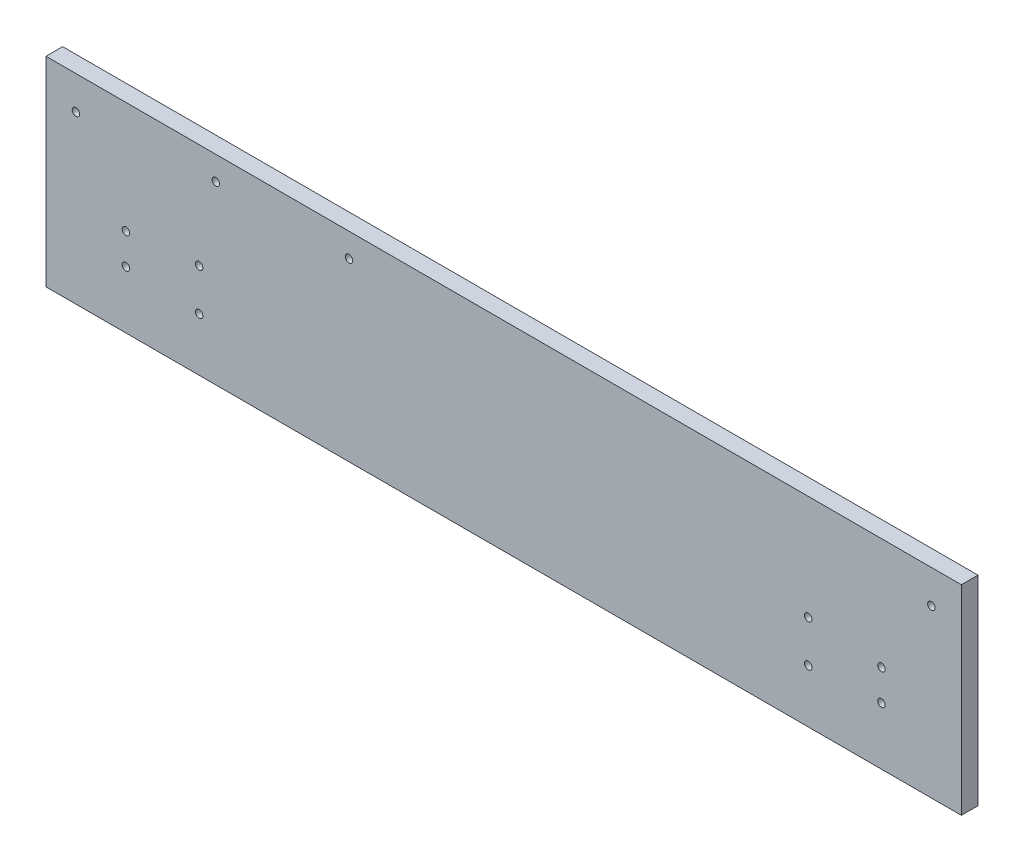
from build123d import *

# Parameters (mm, degrees)
SCHIZZO1_W                   = 550
SCHIZZO1_H                   = 120
ESTRUSIONE_ESTRUSIONE1_DEPTH = 10
SCHIZZO2_R                   = 2.25
TAGLIO_ESTRUSIONE1_DEPTH     = 10
SCHIZZO3_R                   = 2.25
TAGLIO_ESTRUSIONE2_DEPTH     = 10


with BuildPart() as part:
    # Schizzo1 → Estrusione-Estrusione1 (new body)
    with BuildSketch(Plane.XY):
        Rectangle(SCHIZZO1_W, SCHIZZO1_H)
    extrude(amount=ESTRUSIONE_ESTRUSIONE1_DEPTH)

    # Schizzo2 → Taglio-Estrusione1 (cut)
    with BuildSketch(Plane(origin=(0, 0, 0), x_dir=(-1, 0, 0), z_dir=(0, 0, -1))):
        with Locations((-227, -7)):
            Circle(SCHIZZO2_R)
        with Locations((-227, -25.5)):
            Circle(SCHIZZO2_R)
        with Locations((227, -7)):
            Circle(SCHIZZO2_R)
        with Locations((227, -25.5)):
            Circle(SCHIZZO2_R)
        with Locations((-257, 40)):
            Circle(SCHIZZO2_R)
        with Locations((257, 40)):
            Circle(SCHIZZO2_R)
        with Locations((172.925688, 45.7)):
            Circle(SCHIZZO2_R)
        with Locations((92.925688, 45.7)):
            Circle(SCHIZZO2_R)
    extrude(amount=-TAGLIO_ESTRUSIONE1_DEPTH, mode=Mode.SUBTRACT)

    # Schizzo3 → Taglio-Estrusione2 (cut)
    with BuildSketch(Plane.XY.offset(10)):
        with Locations((-183, -3)):
            Circle(SCHIZZO3_R)
        with Locations((-183, -28)):
            Circle(SCHIZZO3_R)
        with Locations((183, -28)):
            Circle(SCHIZZO3_R)
        with Locations((183, -3)):
            Circle(SCHIZZO3_R)
    extrude(amount=-TAGLIO_ESTRUSIONE2_DEPTH, mode=Mode.SUBTRACT)


solid = part.part
